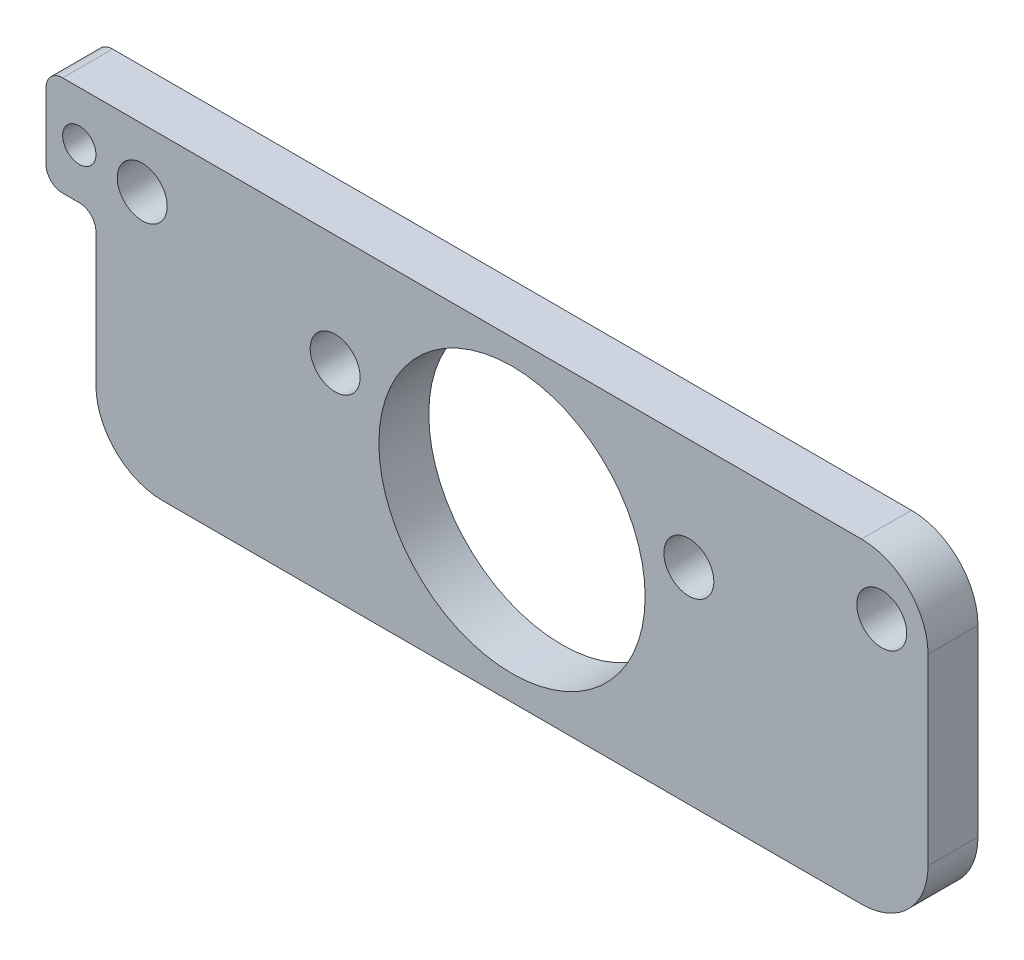
from build123d import *

# Parameters (mm, degrees)
SKETCH_1_R      = 8
SKETCH_1_R_2    = 1.5
SKETCH_1_R_3    = 1
EXTRUDE_1_DEPTH = 3


with BuildPart() as part:
    # Эскиз1 → Бобышка-Вытянуть1 (new body)
    with BuildSketch(Plane.XY):
        with BuildLine():
            Line((-22.026334366, -10.340325606), (19.973665634, -10.340325606))
            ThreePointArc((19.973665634, -10.340325606), (22.802092759, -9.168752731), (23.973665634, -6.340325606))
            Line((23.973665634, -6.340325606), (23.973665634, 4.659674394))
            ThreePointArc((23.973665634, 4.659674394), (22.802092759, 7.488101519), (19.973665634, 8.659674394))
            Line((19.973665634, 8.659674394), (-22.026334366, 8.659674394))
            Line((-22.026334366, 8.659674394), (-28.026334366, 8.659674394))
            ThreePointArc((-28.026334366, 8.659674394), (-28.733441147, 8.366781175), (-29.026334366, 7.659674394))
            Line((-29.026334366, 7.659674394), (-29.026334366, 3.659674394))
            ThreePointArc((-29.026334366, 3.659674394), (-28.733441147, 2.952567613), (-28.026334366, 2.659674394))
            Line((-28.026334366, 2.659674394), (-27.026334366, 2.659674394))
            ThreePointArc((-27.026334366, 2.659674394), (-26.319227584, 2.366781175), (-26.026334366, 1.659674394))
            Line((-26.026334366, 1.659674394), (-26.026334366, -6.340325606))
            ThreePointArc((-26.026334366, -6.340325606), (-24.85476149, -9.168752731), (-22.026334366, -10.340325606))
        make_face()
        with Locations((-1.026334366, -0.840325606)):
            Circle(SKETCH_1_R, mode=Mode.SUBTRACT)
        with Locations((-23.24262837, 5.112512431)):
            Circle(SKETCH_1_R_2, mode=Mode.SUBTRACT)
        with Locations((-11.651518455, 2.00668389)):
            Circle(SKETCH_1_R_2, mode=Mode.SUBTRACT)
        with Locations(Location((9.598849724, 2.00668389, 0), (0, 0, 180))):
            Circle(SKETCH_1_R_2, mode=Mode.SUBTRACT)
        with Locations(Location((21.189959639, 5.112512431, 0), (0, 0, 180))):
            Circle(SKETCH_1_R_2, mode=Mode.SUBTRACT)
        with Locations((-27.026334366, 5.659674394)):
            Circle(SKETCH_1_R_3, mode=Mode.SUBTRACT)
    extrude(amount=EXTRUDE_1_DEPTH)


solid = part.part
